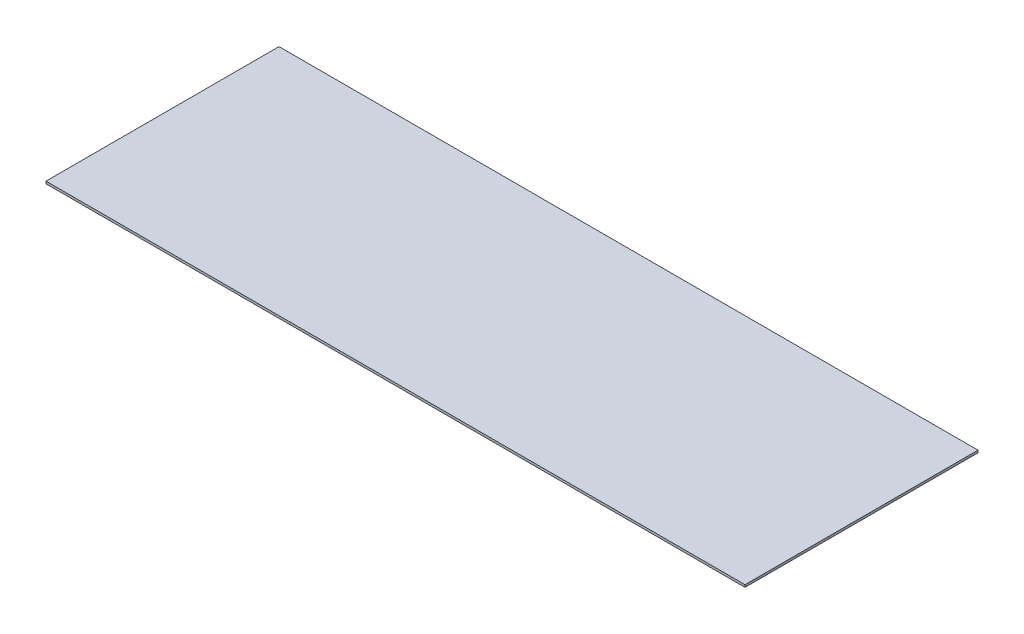
from build123d import *

# Parameters (mm, degrees)
SKETCH_1_W      = 300
SKETCH_1_H      = 100
EXTRUDE_1_DEPTH = 1


with BuildPart() as part:
    # ｽｹｯﾁ1 → ﾎﾞｽ - 押し出し1 (new body)
    with BuildSketch(Plane(origin=(0, 0, 0), x_dir=(1, 0, 0), z_dir=(0, 1, 0))):
        with Locations((150, 50)):
            Rectangle(SKETCH_1_W, SKETCH_1_H)
    extrude(amount=EXTRUDE_1_DEPTH)


solid = part.part
